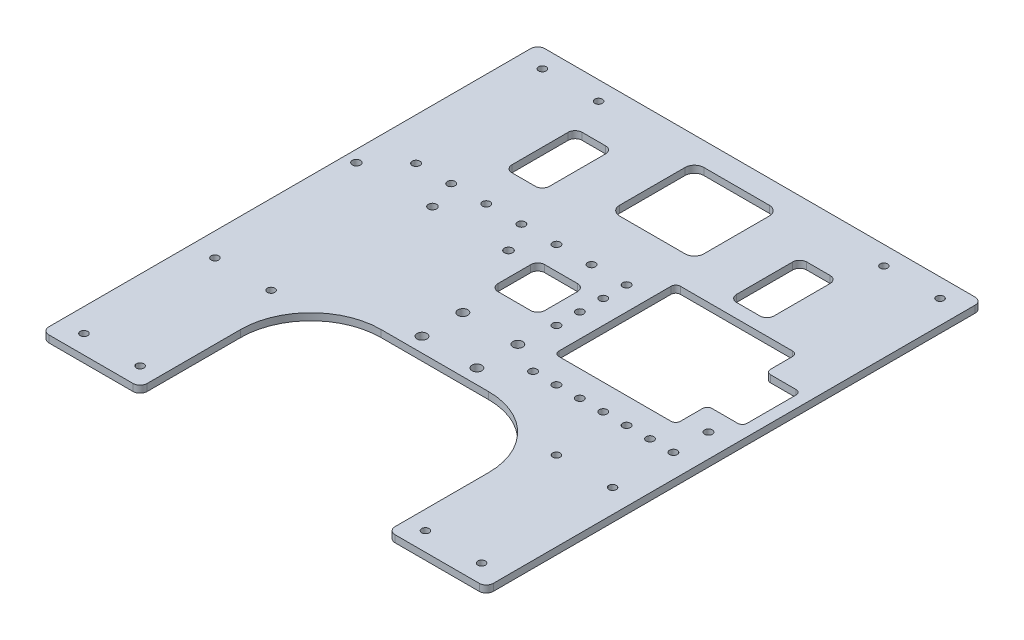
from build123d import *

# Parameters (mm, degrees)
SKETCH_1_R             = 2.1
SKETCH_1_R_2           = 1.6
EXTRUDE_1_DEPTH        = 3
HOLE_WIZARD_1_D        = 3.5
HOLE_WIZARD_2_D        = 3.3
PATTERN_LINEAR_1_COUNT = 7
PATTERN_LINEAR_1_PITCH = 15
PATTERN_LINEAR_2_COUNT = 4
PATTERN_LINEAR_2_PITCH = 10
HOLE_WIZARD_3_D        = 3.3
PATTERN_LINEAR_3_COUNT = 7
PATTERN_LINEAR_3_PITCH = 10
HOLE_WIZARD_4_D        = 3.3
SKETCH_14_W            = 20
SKETCH_14_H            = 20
CUT_EXTRUDE_1_DEPTH    = 10
FILLET_1_R             = 3


with BuildPart() as part:
    # 草图1 → 凸台-拉伸1 (new body)
    with BuildSketch(Plane(origin=(0, 0, 0), x_dir=(1, 0, 0), z_dir=(0, 1, 0))):
        with BuildLine():
            Line((-95, 3), (-95, 209))
            ThreePointArc((-95, 209), (-94.121320344, 211.121320344), (-92, 212))
            Line((-92, 212), (92, 212))
            ThreePointArc((92, 212), (94.121320344, 211.121320344), (95, 209))
            Line((95, 209), (95, 3))
            ThreePointArc((95, 3), (94.121320344, 0.878679656), (92, 0))
            Line((92, 0), (56, 0))
            ThreePointArc((56, 0), (53.878679656, 0.878679656), (53, 3))
            Line((53, 3), (53, 43))
            ThreePointArc((53, 43), (44.213203436, 64.213203436), (23, 73))
            Line((23, 73), (-23, 73))
            ThreePointArc((-23, 73), (-44.213203436, 64.213203436), (-53, 43))
            Line((-53, 43), (-53, 3))
            ThreePointArc((-53, 3), (-53.878679656, 0.878679656), (-56, 0))
            Line((-56, 0), (-92, 0))
            ThreePointArc((-92, 0), (-94.121320344, 0.878679656), (-95, 3))
        make_face()
        with Locations(Location((-11.75, 96.75, 0), (0, 0, 270))):
            Circle(SKETCH_1_R, mode=Mode.SUBTRACT)
        with Locations(Location((11.75, 96.75, 0), (0, 0, 270))):
            Circle(SKETCH_1_R, mode=Mode.SUBTRACT)
        with Locations(Location((11.75, 79.25, 0), (0, 0, 270))):
            Circle(SKETCH_1_R, mode=Mode.SUBTRACT)
        with Locations(Location((-11.75, 79.25, 0), (0, 0, 270))):
            Circle(SKETCH_1_R, mode=Mode.SUBTRACT)
        with Locations(Location((-85, 204, 0), (0, 0, 270))):
            Circle(SKETCH_1_R_2, mode=Mode.SUBTRACT)
        with Locations(Location((-61, 204, 0), (0, 0, 270))):
            Circle(SKETCH_1_R_2, mode=Mode.SUBTRACT)
        with Locations(Location((-61, 8, 0), (0, 0, 270))):
            Circle(SKETCH_1_R_2, mode=Mode.SUBTRACT)
        with Locations(Location((-85, 8, 0), (0, 0, 270))):
            Circle(SKETCH_1_R_2, mode=Mode.SUBTRACT)
        with Locations(Location((85, 8, 0), (0, 0, 90))):
            Circle(SKETCH_1_R_2, mode=Mode.SUBTRACT)
        with Locations(Location((61, 8, 0), (0, 0, 90))):
            Circle(SKETCH_1_R_2, mode=Mode.SUBTRACT)
        with Locations(Location((61, 204, 0), (0, 0, 90))):
            Circle(SKETCH_1_R_2, mode=Mode.SUBTRACT)
        with Locations(Location((85, 204, 0), (0, 0, 90))):
            Circle(SKETCH_1_R_2, mode=Mode.SUBTRACT)
        with Locations(Location((85, 64, 0), (0, 0, 270))):
            Circle(SKETCH_1_R_2, mode=Mode.SUBTRACT)
        with Locations(Location((61, 64, 0), (0, 0, 270))):
            Circle(SKETCH_1_R_2, mode=Mode.SUBTRACT)
        with Locations(Location((-85, 64, 0), (0, 0, 90))):
            Circle(SKETCH_1_R_2, mode=Mode.SUBTRACT)
        with Locations(Location((-61, 64, 0), (0, 0, 90))):
            Circle(SKETCH_1_R_2, mode=Mode.SUBTRACT)
        with BuildLine():
            Line((-56, 186), (-56, 162))
            ThreePointArc((-56, 162), (-55.121320344, 159.878679656), (-53, 159))
            Line((-53, 159), (-43, 159))
            ThreePointArc((-43, 159), (-40.878679656, 159.878679656), (-40, 162))
            Line((-40, 162), (-40, 186))
            ThreePointArc((-40, 186), (-40.878679656, 188.121320344), (-43, 189))
            Line((-43, 189), (-53, 189))
            ThreePointArc((-53, 189), (-55.121320344, 188.121320344), (-56, 186))
        make_face(mode=Mode.SUBTRACT)
        with BuildLine():
            Line((43, 189), (53, 189))
            ThreePointArc((53, 189), (55.121320344, 188.121320344), (56, 186))
            Line((56, 186), (56, 162))
            ThreePointArc((56, 162), (55.121320344, 159.878679656), (53, 159))
            Line((53, 159), (43, 159))
            ThreePointArc((43, 159), (40.878679656, 159.878679656), (40, 162))
            Line((40, 162), (40, 186))
            ThreePointArc((40, 186), (40.878679656, 188.121320344), (43, 189))
        make_face(mode=Mode.SUBTRACT)
        with BuildLine():
            Line((77, 139.5), (88, 139.5))
            ThreePointArc((88, 139.5), (89.414213562, 138.914213562), (90, 137.5))
            Line((90, 137.5), (90, 116.5))
            ThreePointArc((90, 116.5), (89.414213562, 115.085786438), (88, 114.5))
            Line((88, 114.5), (77, 114.5))
            ThreePointArc((77, 114.5), (75.585786438, 113.914213562), (75, 112.5))
            Line((75, 112.5), (75, 103))
            ThreePointArc((75, 103), (74.414213562, 101.585786438), (73, 101))
            Line((73, 101), (25, 101))
            ThreePointArc((25, 101), (23.585786438, 101.585786438), (23, 103))
            Line((23, 103), (23, 151))
            ThreePointArc((23, 151), (23.585786438, 152.414213562), (25, 153))
            Line((25, 153), (73, 153))
            ThreePointArc((73, 153), (74.414213562, 152.414213562), (75, 151))
            Line((75, 151), (75, 141.5))
            ThreePointArc((75, 141.5), (75.585786438, 140.085786438), (77, 139.5))
        make_face(mode=Mode.SUBTRACT)
        with BuildLine():
            Line((-14, 166), (14, 166))
            ThreePointArc((14, 166), (16.828427125, 167.171572875), (18, 170))
            Line((18, 170), (18, 198))
            ThreePointArc((18, 198), (16.828427125, 200.828427125), (14, 202))
            Line((14, 202), (-14, 202))
            ThreePointArc((-14, 202), (-16.828427125, 200.828427125), (-18, 198))
            Line((-18, 198), (-18, 170))
            ThreePointArc((-18, 170), (-16.828427125, 167.171572875), (-14, 166))
        make_face(mode=Mode.SUBTRACT)
    extrude(amount=EXTRUDE_1_DEPTH)

    # 孔1 (through all)
    with Locations(Plane(origin=(0, 0, 0), x_dir=(-1, 0, 0), z_dir=(0, -1, 0))):
        with Locations((90, 129.5), (57.5, 129.5), (25, 129.5)):
            Hole(HOLE_WIZARD_1_D / 2)

    # 孔2 (through all)
    with Locations(Plane(origin=(0, 3, 0), x_dir=(1, 0, 0), z_dir=(0, 1, 0))):
        with Locations((13, 142)):
            hole_wizard_2 = Hole(HOLE_WIZARD_2_D / 2)

    # 阵列(线性)1: 孔2 ×7
    with Locations(*[(-i * PATTERN_LINEAR_1_PITCH, 0, 0) for i in range(1, PATTERN_LINEAR_1_COUNT)]):
        add(hole_wizard_2, mode=Mode.SUBTRACT)

    # 阵列(线性)2: 孔2 ×4
    with Locations(*[(0, 0, i * PATTERN_LINEAR_2_PITCH) for i in range(1, PATTERN_LINEAR_2_COUNT)]):
        add(hole_wizard_2, mode=Mode.SUBTRACT)

    # 孔3 (through all)
    with Locations(Plane(origin=(0, 3, 0), x_dir=(1, 0, 0), z_dir=(0, 1, 0))):
        with Locations((25, 90)):
            hole_wizard_3 = Hole(HOLE_WIZARD_3_D / 2)

    # 阵列(线性)3: 孔3 ×7
    with Locations(*[(i * PATTERN_LINEAR_3_PITCH, 0, 0) for i in range(1, PATTERN_LINEAR_3_COUNT)]):
        add(hole_wizard_3, mode=Mode.SUBTRACT)

    # 孔4 (through all)
    with Locations(Plane(origin=(0, 3, 0), x_dir=(1, 0, 0), z_dir=(0, 1, 0))):
        with Locations((85, 105)):
            Hole(HOLE_WIZARD_4_D / 2)

    # 草图14 → 切除-拉伸1 (cut)
    with BuildSketch(Plane(origin=(0, 3, 0), x_dir=(1, 0, 0), z_dir=(0, 1, 0))):
        with Locations((-5, 122)):
            Rectangle(SKETCH_14_W, SKETCH_14_H)
    extrude(amount=-CUT_EXTRUDE_1_DEPTH, mode=Mode.SUBTRACT)

    # 圆角1
    fillet_1_edges = [part.edges().sort_by_distance(p)[0] for p in [
        (-15, 1.5, -112),
        (-15, 1.5, -132),
        (5, 1.5, -132),
        (5, 1.5, -112),
    ]]
    fillet(fillet_1_edges, radius=FILLET_1_R)


solid = part.part
